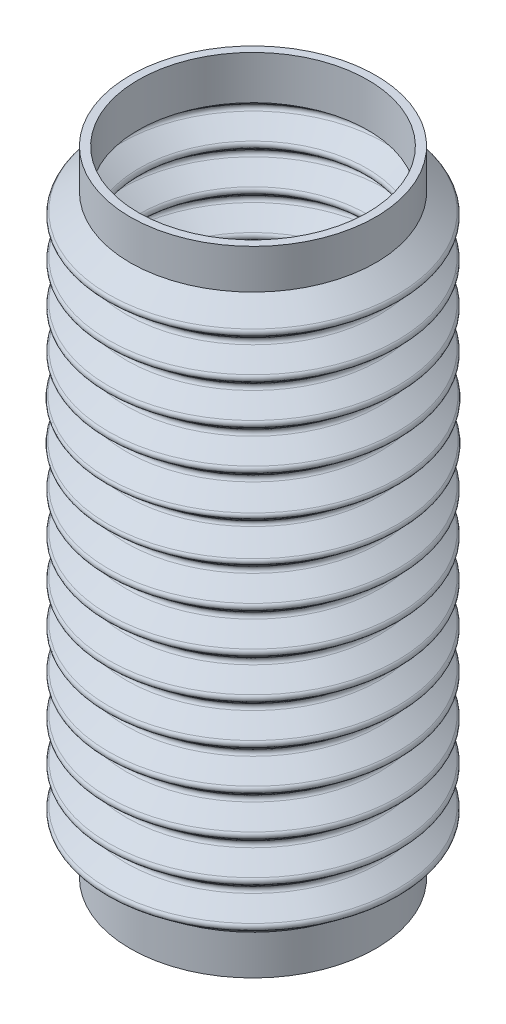
from build123d import *


with BuildPart() as part:
    # Sketch1 → Revolve1 (revolve)
    with BuildSketch(Plane(origin=(0, 0, 0), x_dir=(0, 0, -1), z_dir=(1, 0, 0))):
        with BuildLine():
            Line((-31, 31.12340293), (-31, 21.12340293))
            Line((-31, 21.12340293), (-36.469588814, 16.916026919))
            ThreePointArc((-36.469588814, 16.916026919), (-36.859878053, 16.12340293), (-36.469588814, 15.33077894))
            Line((-36.469588814, 15.33077894), (-32.030411186, 11.916026919))
            ThreePointArc((-32.030411186, 11.916026919), (-31.640121947, 11.12340293), (-32.030411186, 10.33077894))
            Line((-32.030411186, 10.33077894), (-36.469588814, 6.916026919))
            ThreePointArc((-36.469588814, 6.916026919), (-36.859878053, 6.12340293), (-36.469588814, 5.33077894))
            Line((-36.469588814, 5.33077894), (-32.030411186, 1.916026919))
            ThreePointArc((-32.030411186, 1.916026919), (-31.640121947, 1.12340293), (-32.030411186, 0.33077894))
            Line((-32.030411186, 0.33077894), (-36.469588814, -3.083973081))
            ThreePointArc((-36.469588814, -3.083973081), (-36.859878053, -3.87659707), (-36.469588814, -4.66922106))
            Line((-36.469588814, -4.66922106), (-32.030411186, -8.083973081))
            ThreePointArc((-32.030411186, -8.083973081), (-31.640121947, -8.87659707), (-32.030411186, -9.66922106))
            Line((-32.030411186, -9.66922106), (-36.469588814, -13.083973081))
            ThreePointArc((-36.469588814, -13.083973081), (-36.859878053, -13.87659707), (-36.469588814, -14.66922106))
            Line((-36.469588814, -14.66922106), (-32.030411186, -18.083973081))
            ThreePointArc((-32.030411186, -18.083973081), (-31.640121947, -18.87659707), (-32.030411186, -19.66922106))
            Line((-32.030411186, -19.66922106), (-36.633073678, -23.209730669))
            ThreePointArc((-36.633073678, -23.209730669), (-36.961439693, -23.87659707), (-36.633073678, -24.543463472))
            Line((-36.633073678, -24.543463472), (-31.866926322, -28.209730669))
            ThreePointArc((-31.866926322, -28.209730669), (-31.538560307, -28.87659707), (-31.866926322, -29.543463472))
            Line((-31.866926322, -29.543463472), (-36.633073678, -33.209730669))
            ThreePointArc((-36.633073678, -33.209730669), (-36.961439693, -33.87659707), (-36.633073678, -34.543463472))
            Line((-36.633073678, -34.543463472), (-32.030411186, -38.083973081))
            ThreePointArc((-32.030411186, -38.083973081), (-31.640121947, -38.87659707), (-32.030411186, -39.66922106))
            Line((-32.030411186, -39.66922106), (-36.469588814, -43.083973081))
            ThreePointArc((-36.469588814, -43.083973081), (-36.859878053, -43.87659707), (-36.469588814, -44.66922106))
            Line((-36.469588814, -44.66922106), (-32.030411186, -48.083973081))
            ThreePointArc((-32.030411186, -48.083973081), (-31.640121947, -48.87659707), (-32.030411186, -49.66922106))
            Line((-32.030411186, -49.66922106), (-36.469588814, -53.083973081))
            ThreePointArc((-36.469588814, -53.083973081), (-36.859878053, -53.87659707), (-36.469588814, -54.66922106))
            Line((-36.469588814, -54.66922106), (-32.030411186, -58.083973081))
            ThreePointArc((-32.030411186, -58.083973081), (-31.640121947, -58.87659707), (-32.030411186, -59.66922106))
            Line((-32.030411186, -59.66922106), (-36.469588814, -63.083973081))
            ThreePointArc((-36.469588814, -63.083973081), (-36.859878053, -63.87659707), (-36.469588814, -64.66922106))
            Line((-36.469588814, -64.66922106), (-32.030411186, -68.083973081))
            ThreePointArc((-32.030411186, -68.083973081), (-31.640121947, -68.87659707), (-32.030411186, -69.66922106))
            Line((-32.030411186, -69.66922106), (-36.469588814, -73.083973081))
            ThreePointArc((-36.469588814, -73.083973081), (-36.859878053, -73.87659707), (-36.469588814, -74.66922106))
            Line((-36.469588814, -74.66922106), (-32.030411186, -78.083973081))
            ThreePointArc((-32.030411186, -78.083973081), (-31.640121947, -78.87659707), (-32.030411186, -79.66922106))
            Line((-32.030411186, -79.66922106), (-36.469588814, -83.083973081))
            ThreePointArc((-36.469588814, -83.083973081), (-36.859878053, -83.87659707), (-36.469588814, -84.66922106))
            Line((-36.469588814, -84.66922106), (-32.030411186, -88.083973081))
            ThreePointArc((-32.030411186, -88.083973081), (-31.640121947, -88.87659707), (-32.030411186, -89.66922106))
            Line((-32.030411186, -89.66922106), (-36.469588814, -93.083973081))
            ThreePointArc((-36.469588814, -93.083973081), (-36.859878053, -93.87659707), (-36.469588814, -94.66922106))
            Line((-36.469588814, -94.66922106), (-32.030411186, -98.083973081))
            ThreePointArc((-32.030411186, -98.083973081), (-31.640121947, -98.87659707), (-32.030411186, -99.66922106))
            Line((-32.030411186, -99.66922106), (-36.469588814, -103.083973081))
            ThreePointArc((-36.469588814, -103.083973081), (-36.859878053, -103.87659707), (-36.469588814, -104.66922106))
            Line((-36.469588814, -104.66922106), (-32.030411186, -108.083973081))
            ThreePointArc((-32.030411186, -108.083973081), (-31.640121947, -108.87659707), (-32.030411186, -109.66922106))
            Line((-32.030411186, -109.66922106), (-36.469588814, -113.083973081))
            ThreePointArc((-36.469588814, -113.083973081), (-36.859878053, -113.87659707), (-36.469588814, -114.66922106))
            Line((-36.469588814, -114.66922106), (-31, -118.87659707))
            Line((-31, -118.87659707), (-31, -128.87659707))
            Line((-31, -128.87659707), (-29, -128.87659707))
            Line((-29, -128.87659707), (-29, -117.891794076))
            Line((-29, -117.891794076), (-33.189344921, -114.66922106))
            ThreePointArc((-33.189344921, -114.66922106), (-33.57963416, -113.87659707), (-33.189344921, -113.083973081))
            Line((-33.189344921, -113.083973081), (-28.750167292, -109.66922106))
            ThreePointArc((-28.750167292, -109.66922106), (-28.359878053, -108.87659707), (-28.750167292, -108.083973081))
            Line((-28.750167292, -108.083973081), (-33.189344921, -104.66922106))
            ThreePointArc((-33.189344921, -104.66922106), (-33.57963416, -103.87659707), (-33.189344921, -103.083973081))
            Line((-33.189344921, -103.083973081), (-28.750167292, -99.66922106))
            ThreePointArc((-28.750167292, -99.66922106), (-28.359878053, -98.87659707), (-28.750167292, -98.083973081))
            Line((-28.750167292, -98.083973081), (-33.189344921, -94.66922106))
            ThreePointArc((-33.189344921, -94.66922106), (-33.57963416, -93.87659707), (-33.189344921, -93.083973081))
            Line((-33.189344921, -93.083973081), (-28.750167292, -89.66922106))
            ThreePointArc((-28.750167292, -89.66922106), (-28.359878053, -88.87659707), (-28.750167292, -88.083973081))
            Line((-28.750167292, -88.083973081), (-33.189344921, -84.66922106))
            ThreePointArc((-33.189344921, -84.66922106), (-33.57963416, -83.87659707), (-33.189344921, -83.083973081))
            Line((-33.189344921, -83.083973081), (-28.750167292, -79.66922106))
            ThreePointArc((-28.750167292, -79.66922106), (-28.359878053, -78.87659707), (-28.750167292, -78.083973081))
            Line((-28.750167292, -78.083973081), (-33.189344921, -74.66922106))
            ThreePointArc((-33.189344921, -74.66922106), (-33.57963416, -73.87659707), (-33.189344921, -73.083973081))
            Line((-33.189344921, -73.083973081), (-28.750167292, -69.66922106))
            ThreePointArc((-28.750167292, -69.66922106), (-28.359878053, -68.87659707), (-28.750167292, -68.083973081))
            Line((-28.750167292, -68.083973081), (-33.189344921, -64.66922106))
            ThreePointArc((-33.189344921, -64.66922106), (-33.57963416, -63.87659707), (-33.189344921, -63.083973081))
            Line((-33.189344921, -63.083973081), (-28.750167292, -59.66922106))
            ThreePointArc((-28.750167292, -59.66922106), (-28.359878053, -58.87659707), (-28.750167292, -58.083973081))
            Line((-28.750167292, -58.083973081), (-33.189344921, -54.66922106))
            ThreePointArc((-33.189344921, -54.66922106), (-33.57963416, -53.87659707), (-33.189344921, -53.083973081))
            Line((-33.189344921, -53.083973081), (-28.750167292, -49.66922106))
            ThreePointArc((-28.750167292, -49.66922106), (-28.359878053, -48.87659707), (-28.750167292, -48.083973081))
            Line((-28.750167292, -48.083973081), (-33.189344921, -44.66922106))
            ThreePointArc((-33.189344921, -44.66922106), (-33.57963416, -43.87659707), (-33.189344921, -43.083973081))
            Line((-33.189344921, -43.083973081), (-28.750167292, -39.66922106))
            ThreePointArc((-28.750167292, -39.66922106), (-28.359878053, -38.87659707), (-28.750167292, -38.083973081))
            Line((-28.750167292, -38.083973081), (-33.352829785, -34.543463472))
            ThreePointArc((-33.352829785, -34.543463472), (-33.6811958, -33.87659707), (-33.352829785, -33.209730669))
            Line((-33.352829785, -33.209730669), (-28.586682428, -29.543463472))
            ThreePointArc((-28.586682428, -29.543463472), (-28.258316414, -28.87659707), (-28.586682428, -28.209730669))
            Line((-28.586682428, -28.209730669), (-33.352829785, -24.543463472))
            ThreePointArc((-33.352829785, -24.543463472), (-33.6811958, -23.87659707), (-33.352829785, -23.209730669))
            Line((-33.352829785, -23.209730669), (-28.750167292, -19.66922106))
            ThreePointArc((-28.750167292, -19.66922106), (-28.359878053, -18.87659707), (-28.750167292, -18.083973081))
            Line((-28.750167292, -18.083973081), (-33.189344921, -14.66922106))
            ThreePointArc((-33.189344921, -14.66922106), (-33.57963416, -13.87659707), (-33.189344921, -13.083973081))
            Line((-33.189344921, -13.083973081), (-28.750167292, -9.66922106))
            ThreePointArc((-28.750167292, -9.66922106), (-28.359878053, -8.87659707), (-28.750167292, -8.083973081))
            Line((-28.750167292, -8.083973081), (-33.189344921, -4.66922106))
            ThreePointArc((-33.189344921, -4.66922106), (-33.57963416, -3.87659707), (-33.189344921, -3.083973081))
            Line((-33.189344921, -3.083973081), (-28.750167292, 0.33077894))
            ThreePointArc((-28.750167292, 0.33077894), (-28.359878053, 1.12340293), (-28.750167292, 1.916026919))
            Line((-28.750167292, 1.916026919), (-33.189344921, 5.33077894))
            ThreePointArc((-33.189344921, 5.33077894), (-33.57963416, 6.12340293), (-33.189344921, 6.916026919))
            Line((-33.189344921, 6.916026919), (-28.750167292, 10.33077894))
            ThreePointArc((-28.750167292, 10.33077894), (-28.359878053, 11.12340293), (-28.750167292, 11.916026919))
            Line((-28.750167292, 11.916026919), (-33.189344921, 15.33077894))
            ThreePointArc((-33.189344921, 15.33077894), (-33.57963416, 16.12340293), (-33.189344921, 16.916026919))
            Line((-33.189344921, 16.916026919), (-29, 20.138599935))
            Line((-29, 20.138599935), (-29, 31.12340293))
            Line((-29, 31.12340293), (-31, 31.12340293))
        make_face()
    revolve(axis=Axis((0, 63.257575758, 0), (0, -1, 0)))


solid = part.part
